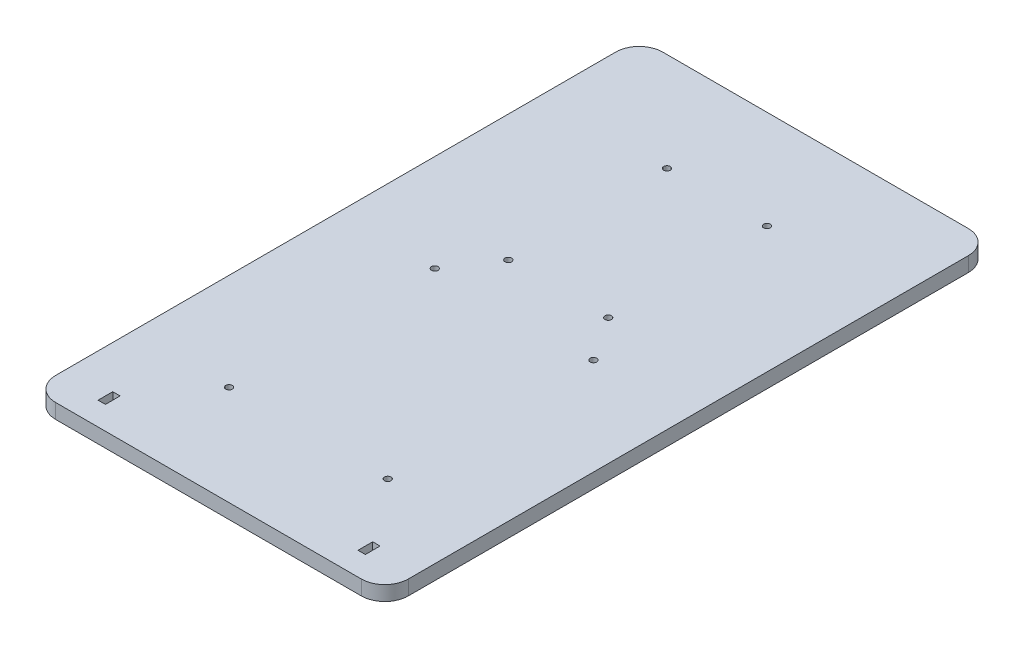
from build123d import *

# Parameters (mm, degrees)
SKETCH3_W           = 152.4
SKETCH3_H           = 262.339276313
SKETCH3_R           = 1.4224
SKETCH3_W_2         = 3.175
SKETCH3_H_2         = 6.35
BOSS_EXTRUDE1_DEPTH = 6.35
FILLET1_R           = 10.16


with BuildPart() as part:
    # Sketch3 → Boss-Extrude1 (new body)
    with BuildSketch(Plane(origin=(0, 0, 0), x_dir=(1, 0, 0), z_dir=(0, 1, 0))):
        with Locations((76.2, 131.169638157)):
            Rectangle(SKETCH3_W, SKETCH3_H)
        with Locations(Location((41.91, 43.18, 0), (0, 0, 270))):
            Circle(SKETCH3_R, mode=Mode.SUBTRACT)
        with Locations(Location((41.91, 132.08, 0), (0, 0, 270))):
            Circle(SKETCH3_R, mode=Mode.SUBTRACT)
        with Locations(Location((110.49, 132.08, 0), (0, 0, 90))):
            Circle(SKETCH3_R, mode=Mode.SUBTRACT)
        with Locations(Location((110.49, 43.18, 0), (0, 0, 90))):
            Circle(SKETCH3_R, mode=Mode.SUBTRACT)
        with Locations(Location((54.61, 151.157668748, 0), (0, 0, 270))):
            Circle(SKETCH3_R, mode=Mode.SUBTRACT)
        with Locations(Location((54.61, 219.737668748, 0), (0, 0, 270))):
            Circle(SKETCH3_R, mode=Mode.SUBTRACT)
        with Locations(Location((97.79, 151.157668748, 0), (0, 0, 90))):
            Circle(SKETCH3_R, mode=Mode.SUBTRACT)
        with Locations(Location((97.79, 219.737668748, 0), (0, 0, 90))):
            Circle(SKETCH3_R, mode=Mode.SUBTRACT)
        with Locations((20.0285604, 13.212735966)):
            Rectangle(SKETCH3_W_2, SKETCH3_H_2, mode=Mode.SUBTRACT)
        with Locations((132.3714396, 13.212735966)):
            Rectangle(SKETCH3_W_2, SKETCH3_H_2, mode=Mode.SUBTRACT)
    extrude(amount=BOSS_EXTRUDE1_DEPTH)

    # Fillet1
    fillet1_edges = [part.edges().sort_by_distance(p)[0] for p in [
        (0, 3.175, -262.339276313),
        (152.4, 3.175, -262.339276313),
        (152.4, 3.175, 0),
        (0, 3.175, 0),
    ]]
    fillet(fillet1_edges, radius=FILLET1_R)


solid = part.part
